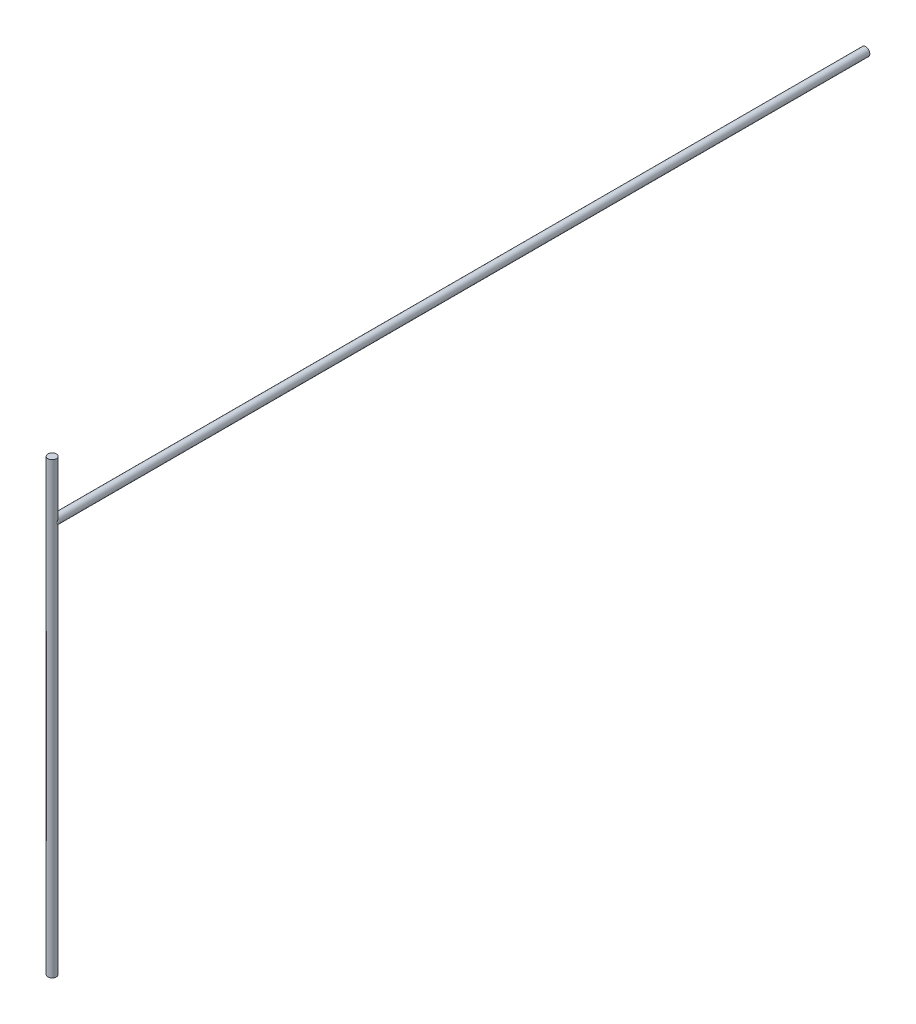
from build123d import *

# Parameters (mm, degrees)
SKETCH_1_R           = 0.75
EXTRUDE_1_DEPTH      = 145
EXTRUDE_2_DEPTH      = 10
EXTRUDE_2_DEPTH_BACK = 70
SKETCH_2_R           = 0.75
MOVE_BODY_1_ANGLE    = 180


with BuildPart() as part:
    # 草图1 → 凸台-拉伸1 (new body)
    with BuildSketch(Plane.XY):
        Circle(SKETCH_1_R)
    extrude(amount=EXTRUDE_1_DEPTH)

    # 草图2 → 凸台-拉伸2 (add, two sides: drawn at the far end of the back side and taken through both)
    with BuildSketch(Plane(origin=(0, 0, 0), x_dir=(1, 0, 0), z_dir=(0, 1, 0)).offset(-EXTRUDE_2_DEPTH_BACK)):
        with Locations(Location((0, 0, 0), (0, 0, 270))):
            Circle(SKETCH_2_R)
    extrude(amount=EXTRUDE_2_DEPTH + EXTRUDE_2_DEPTH_BACK)


with BuildPart() as part_1:
    # Move Body 1: moved
    add(part.part.rotate(Axis((0, 0, 0), (0, 1, 0)), MOVE_BODY_1_ANGLE))


solid = part_1.part
